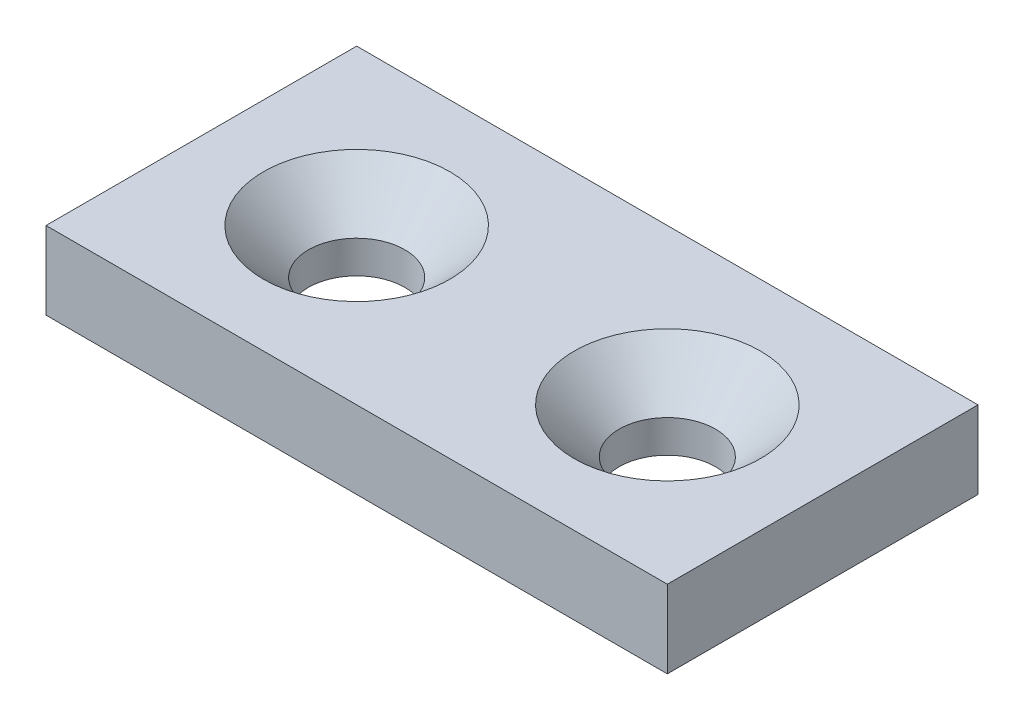
from build123d import *

# Parameters (mm, degrees)
SKETCH_1_W               = 40
SKETCH_1_H               = 20
EXTRUDE_1_DEPTH          = 5
HOLE_WIZARD_1_AT_2_COUNT = 2
HOLE_WIZARD_1_AT_2_PITCH = 20


with BuildPart() as part:
    # 草图1 → 凸台-拉伸1 (new body)
    with BuildSketch(Plane(origin=(0, 0, 0), x_dir=(1, 0, 0), z_dir=(0, 1, 0))):
        Rectangle(SKETCH_1_W, SKETCH_1_H)
    extrude(amount=EXTRUDE_1_DEPTH)

    # 草图3 → 打孔尺寸(%根据)内六角花形半沉头螺钉的类型1 (revolve, cut)
    with BuildSketch(Plane(origin=(-10, 5, 0), x_dir=(0, 0, 1), z_dir=(1, 0, 0))):
        Polygon((0, 0), (0, 5), (3.1, 5), (3.1, 2.9), (6, 0), align=None)
    hole_wizard_1 = revolve(axis=Axis((-10, 11.35, 0), (0, -1, 0)), mode=Mode.SUBTRACT)

    # 打孔尺寸(%根据)内六角花形半沉头螺钉的类型1 at 2: 打孔尺寸(%根据)内六角花形半沉头螺钉的类型1 ×2
    with Locations(*[(i * HOLE_WIZARD_1_AT_2_PITCH, 0, 0) for i in range(1, HOLE_WIZARD_1_AT_2_COUNT)]):
        add(hole_wizard_1, mode=Mode.SUBTRACT)


solid = part.part
